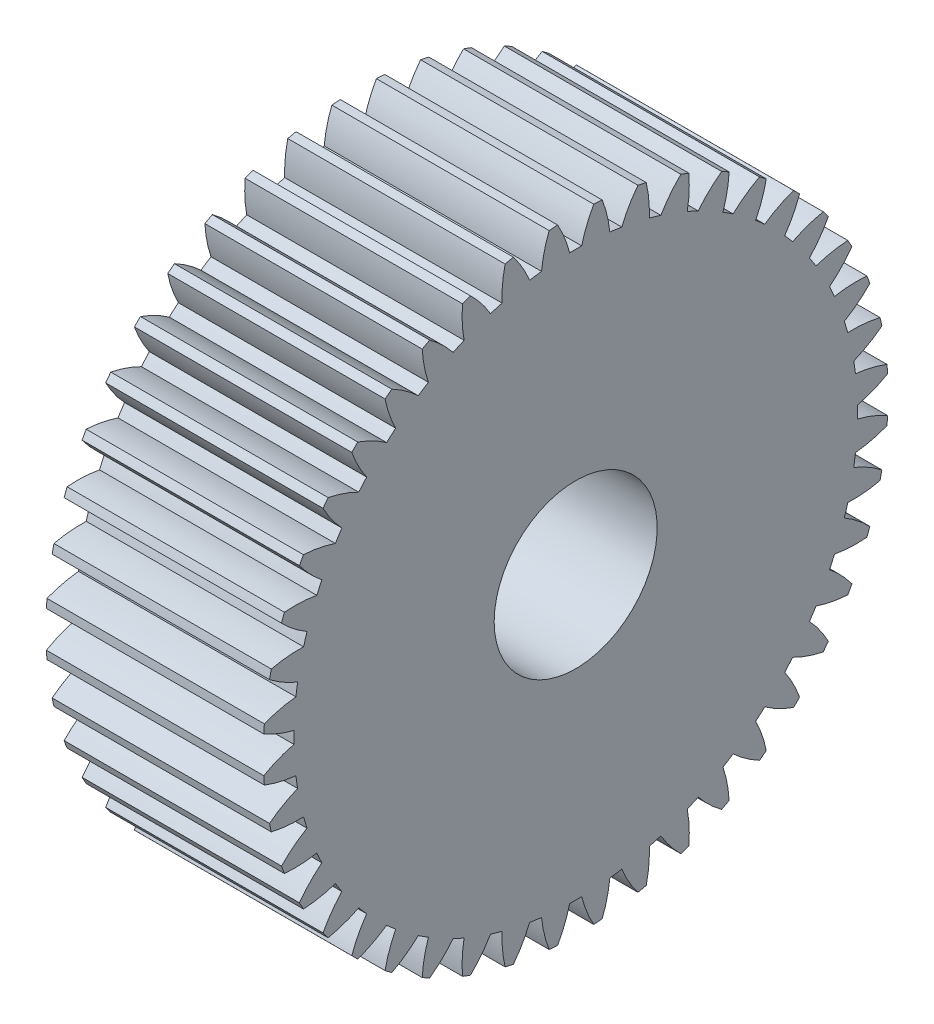
from build123d import *

# Parameters (mm, degrees)
BASPROSKE_W     = 8
BASPROSKE_H     = 11.5
TOOTHCUT_DEPTH  = 19.12456896
TEETHCUTS_COUNT = 44
TEETHCUTS_ANGLE = 351.818181818
BORSKE_R        = 3
BORE_DEPTH      = 50.0000508


with BuildPart() as part:
    # BasProSke → Base-Revolve (revolve)
    with BuildSketch(Plane(origin=(0, 0, 0), x_dir=(1, 0, 0), z_dir=(0, 1, 0)), mode=Mode.PRIVATE) as base_revolve_sk:
        with Locations((4, 5.75)):
            Rectangle(BASPROSKE_W, BASPROSKE_H)
    revolve(base_revolve_sk.sketch.rotate(Axis((-10, 0, 0), (1, 0, 0)), 180), axis=Axis((-10, 0, 0), (1, 0, 0)))

    # TooCutSke → ToothCut (cut, through all)
    with BuildSketch(Plane(origin=(0, 0, 0), x_dir=(0, 0, -1), z_dir=(1, 0, 0))):
        with BuildLine():
            ThreePointArc((0.221729116, 10.371630161), (0, 10.374), (-0.221729116, 10.371630161))
            ThreePointArc((-0.221729116, 10.371630161), (-0.410633561, 10.954460987), (-0.678666239, 11.505401223))
            ThreePointArc((-0.678666239, 11.505401223), (0, 11.5254), (0.678666239, 11.505401223))
            ThreePointArc((0.678666239, 11.505401223), (0.410633561, 10.954460987), (0.221729116, 10.371630161))
        make_face()
    toothcut = extrude(amount=TOOTHCUT_DEPTH, mode=Mode.SUBTRACT)

    # TeethCuts: ToothCut ×44 about axis
    teethcuts_axis = Axis((-10, 0, 0), (1, 0, 0))
    for i in range(1, TEETHCUTS_COUNT):
        add(toothcut.rotate(teethcuts_axis, i * TEETHCUTS_ANGLE / (TEETHCUTS_COUNT - 1)), mode=Mode.SUBTRACT)

    # BorSke → Bore (cut, symmetric)
    with BuildSketch(Plane(origin=(0, 0, 0), x_dir=(0, 0, -1), z_dir=(1, 0, 0))):
        with Locations(Location((0, 0, 0), (0, 0, 180))):
            Circle(BORSKE_R)
    extrude(amount=BORE_DEPTH, both=True, mode=Mode.SUBTRACT)


solid = part.part
